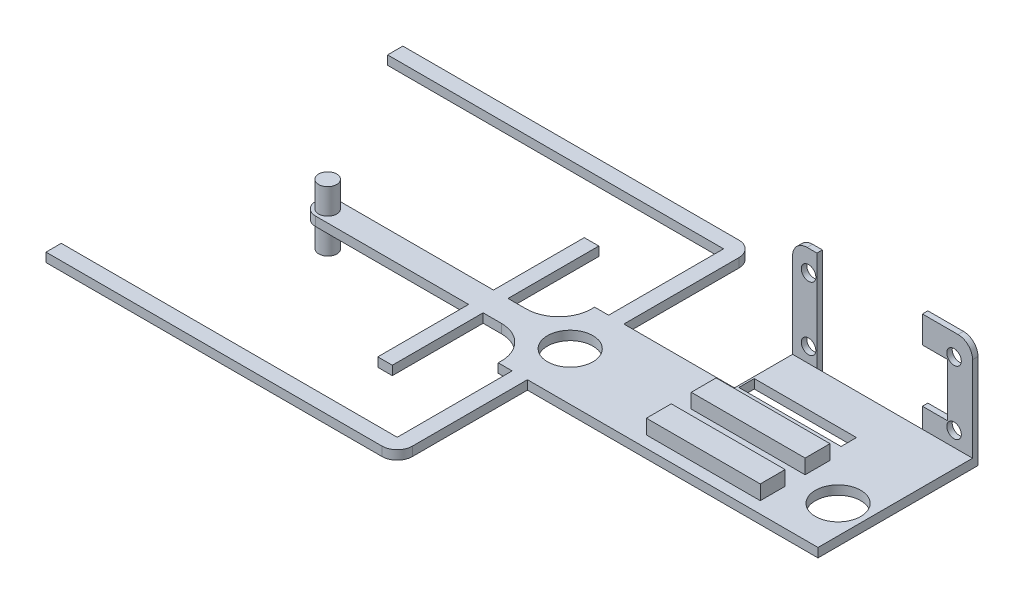
from build123d import *

# Parameters (mm, degrees)
SKETCH1_W           = 6.27
SKETCH1_H           = 1.37
SKETCH1_R           = 1.25
SKETCH1_W_2         = 5.63
SKETCH1_H_2         = 0.85
SKETCH1_R_2         = 0.685
SKETCH1_R_3         = 0.5
SKETCH1_W_3         = 1.34
SKETCH1_H_3         = 0.3
SKETCH1_W_4         = 2.76
BOSS_EXTRUDE2_DEPTH = 0.5
SKETCH4_R           = 0.5
BOSS_EXTRUDE3_DEPTH = 1.41
SKETCH5_R           = 0.5
BOSS_EXTRUDE4_DEPTH = 1.41
SKETCH6_W           = 6.27
SKETCH6_H           = 1.37
BOSS_EXTRUDE5_DEPTH = 0.8
SKETCH7_W           = 1.34
SKETCH7_H           = 0.3
SKETCH7_W_2         = 2.76
BOSS_EXTRUDE6_DEPTH = 5.5
SKETCH8_W           = 1.38
SKETCH8_H           = 2.92
CUT_EXTRUDE1_DEPTH  = 5.5
SKETCH9_R           = 0.4
CUT_EXTRUDE2_DEPTH  = 5.5
SKETCH10_R          = 0.4
CUT_EXTRUDE4_DEPTH  = 5.5
SKETCH11_W          = 0.8
SKETCH11_H          = 0.5
BOSS_EXTRUDE7_DEPTH = 5
SKETCH12_W          = 0.8
SKETCH12_H          = 0.5
BOSS_EXTRUDE8_DEPTH = 5


with BuildPart() as part:
    # Sketch1 → Boss-Extrude2 (new body)
    # profile 1 of 9: a face of its own
    with BuildSketch(Plane(origin=(0, 0, 0), x_dir=(1, 0, 0), z_dir=(0, 1, 0))):
        with BuildLine():
            Line((0, 5.31), (0, 5.14))
            ThreePointArc((0, 5.14), (-0.527207794, 3.867207794), (-1.8, 3.34))
            Line((-1.8, 3.34), (-12.035, 3.34))
            ThreePointArc((-12.035, 3.34), (-11.550631855, 3.139368145), (-11.35, 2.655))
            ThreePointArc((-11.35, 2.655), (-11.550631855, 2.170631855), (-12.035, 1.97))
            Line((-12.035, 1.97), (-1.8, 1.97))
            ThreePointArc((-1.8, 1.97), (-0.527207794, 1.442792206), (0, 0.17))
            Line((0, 0.17), (0, 0))
            Line((0, 0), (0.77, 0))
            Line((0.77, 0), (1.61, 0))
            Line((1.61, 0), (17.61, 0))
            Line((17.61, 0), (17.61, 8.51))
            Line((17.61, 8.51), (14.85, 8.51))
            Line((14.85, 8.51), (9.04, 8.51))
            Line((9.04, 8.51), (7.7, 8.51))
            Line((7.7, 8.51), (7.7, 5.31))
            Line((7.7, 5.31), (1.61, 5.31))
            Line((1.61, 5.31), (0.77, 5.31))
            Line((0.77, 5.31), (0, 5.31))
        make_face()
        with Locations((10.655, 1.325)):
            Rectangle(SKETCH1_W, SKETCH1_H, mode=Mode.SUBTRACT)
        with Locations(Location((1.31, 2.655, 0), (0, 0, 270))):
            Circle(SKETCH1_R, mode=Mode.SUBTRACT)
        with Locations((10.655, 3.795)):
            Rectangle(SKETCH1_W, SKETCH1_H, mode=Mode.SUBTRACT)
        with Locations(Location((16.06, 2.655, 0), (0, 0, 270))):
            Circle(SKETCH1_R, mode=Mode.SUBTRACT)
        with Locations((10.615, 5.875)):
            Rectangle(SKETCH1_W_2, SKETCH1_H_2, mode=Mode.SUBTRACT)
    # profile 2 of 9: a face of its own
    with BuildSketch(Plane(origin=(0, 0, 0), x_dir=(1, 0, 0), z_dir=(0, 1, 0))):
        with BuildLine():
            Line((0.77, 11.64), (0.77, 5.31))
            Line((0.77, 5.31), (1.61, 5.31))
            Line((1.61, 5.31), (1.61, 11.64))
            ThreePointArc((1.61, 11.64), (1.363969696, 12.233969696), (0.77, 12.48))
            Line((0.77, 12.48), (-17.73, 12.48))
            Line((-17.73, 12.48), (-17.73, 11.64))
            Line((-17.73, 11.64), (0.77, 11.64))
        make_face()
    # profile 3 of 9: a face of its own
    with BuildSketch(Plane(origin=(0, 0, 0), x_dir=(1, 0, 0), z_dir=(0, 1, 0))):
        with BuildLine():
            Line((1.61, 0), (0.77, 0))
            Line((0.77, 0), (0.77, -6.33))
            Line((0.77, -6.33), (-17.73, -6.33))
            Line((-17.73, -6.33), (-17.73, -7.17))
            Line((-17.73, -7.17), (0.77, -7.17))
            ThreePointArc((0.77, -7.17), (1.363969696, -6.923969696), (1.61, -6.33))
            Line((1.61, -6.33), (1.61, 0))
        make_face()
    # profile 4 of 9: a face of its own
    with BuildSketch(Plane(origin=(0, 0, 0), x_dir=(1, 0, 0), z_dir=(0, 1, 0))):
        with Locations((10.655, 1.325)):
            Rectangle(SKETCH1_W, SKETCH1_H)
    # profile 5 of 9: a face of its own
    with BuildSketch(Plane(origin=(0, 0, 0), x_dir=(1, 0, 0), z_dir=(0, 1, 0))):
        with Locations((10.655, 3.795)):
            Rectangle(SKETCH1_W, SKETCH1_H)
    # profile 6 of 9: a face of its own
    with BuildSketch(Plane(origin=(0, 0, 0), x_dir=(1, 0, 0), z_dir=(0, 1, 0))):
        with Locations((-12.035, 2.655)):
            Circle(SKETCH1_R_2)
        with Locations((-12.035, 2.655)):
            Circle(SKETCH1_R_3, mode=Mode.SUBTRACT)
    # profile 7 of 9: a face of its own
    with BuildSketch(Plane(origin=(0, 0, 0), x_dir=(1, 0, 0), z_dir=(0, 1, 0))):
        with Locations((-12.035, 2.655)):
            Circle(SKETCH1_R_3)
    # profile 8 of 9: a face of its own
    with BuildSketch(Plane(origin=(0, 0, 0), x_dir=(1, 0, 0), z_dir=(0, 1, 0))):
        with Locations((8.37, 8.66)):
            Rectangle(SKETCH1_W_3, SKETCH1_H_3)
    # profile 9 of 9: a face of its own
    with BuildSketch(Plane(origin=(0, 0, 0), x_dir=(1, 0, 0), z_dir=(0, 1, 0))):
        with Locations((16.23, 8.66)):
            Rectangle(SKETCH1_W_4, SKETCH1_H_3)
    extrude(amount=BOSS_EXTRUDE2_DEPTH)

    # Sketch4 → Boss-Extrude3 (add)
    with BuildSketch(Plane(origin=(0, 0.5, 0), x_dir=(1, 0, 0), z_dir=(0, 1, 0))):
        with Locations(Location((-12.040018383, 2.65, 0), (0, 0, 270))):
            Circle(SKETCH4_R)
    extrude(amount=BOSS_EXTRUDE3_DEPTH)

    # Sketch5 → Boss-Extrude4 (add)
    with BuildSketch(Plane.XZ):
        with Locations(Location((-12.04, -2.66, 0), (0, 0, 90))):
            Circle(SKETCH5_R)
    extrude(amount=BOSS_EXTRUDE4_DEPTH)

    # Sketch6 → Boss-Extrude5 (add)
    with BuildSketch(Plane(origin=(0, 0.5, 0), x_dir=(1, 0, 0), z_dir=(0, 1, 0))):
        with Locations((10.655, 3.795)):
            Rectangle(SKETCH6_W, SKETCH6_H)
        with Locations((10.655, 1.325)):
            Rectangle(SKETCH6_W, SKETCH6_H)
    extrude(amount=BOSS_EXTRUDE5_DEPTH)

    # Sketch7 → Boss-Extrude6 (add)
    with BuildSketch(Plane(origin=(0, 0.5, 0), x_dir=(1, 0, 0), z_dir=(0, 1, 0))):
        with Locations((8.37, 8.66)):
            Rectangle(SKETCH7_W, SKETCH7_H)
        with Locations((16.23, 8.66)):
            Rectangle(SKETCH7_W_2, SKETCH7_H)
    extrude(amount=BOSS_EXTRUDE6_DEPTH)

    # Sketch8 → Cut-Extrude1 (cut)
    with BuildSketch(Plane.XY.offset(-8.51)):
        with Locations((15.54, 3.06)):
            Rectangle(SKETCH8_W, SKETCH8_H)
    extrude(amount=-CUT_EXTRUDE1_DEPTH, mode=Mode.SUBTRACT)

    # Sketch9 → Cut-Extrude2 (cut)
    with BuildSketch(Plane.XY.offset(-8.51)):
        with BuildLine():
            ThreePointArc((7.7, 5.2), (7.934314575, 5.765685425), (8.5, 6))
            Line((8.5, 6), (7.7, 6))
            Line((7.7, 6), (7.7, 5.2))
        make_face()
        with Locations((8.58, 4.82)):
            Circle(SKETCH9_R)
        with Locations((8.58, 1.32)):
            Circle(SKETCH9_R)
    extrude(amount=-CUT_EXTRUDE2_DEPTH, mode=Mode.SUBTRACT)

    # Sketch10 → Cut-Extrude4 (cut)
    with BuildSketch(Plane.XY.offset(-8.51)):
        with Locations((16.59, 4.82)):
            Circle(SKETCH10_R)
        with BuildLine():
            Line((17.61, 6), (16.81, 6))
            ThreePointArc((16.81, 6), (17.375685425, 5.765685425), (17.61, 5.2))
            Line((17.61, 5.2), (17.61, 6))
        make_face()
        with Locations((16.59, 1.32)):
            Circle(SKETCH10_R)
    extrude(amount=-CUT_EXTRUDE4_DEPTH, mode=Mode.SUBTRACT)

    # Sketch11 → Boss-Extrude7 (add)
    with BuildSketch(Plane.XY.offset(-1.97)):
        with Locations((-3.2, 0.25)):
            Rectangle(SKETCH11_W, SKETCH11_H)
    extrude(amount=BOSS_EXTRUDE7_DEPTH)

    # Sketch12 → Boss-Extrude8 (add)
    with BuildSketch(Plane(origin=(0, 0, -3.34), x_dir=(-1, 0, 0), z_dir=(0, 0, -1))):
        with Locations((3.2, 0.25)):
            Rectangle(SKETCH12_W, SKETCH12_H)
    extrude(amount=BOSS_EXTRUDE8_DEPTH)


solid = part.part
